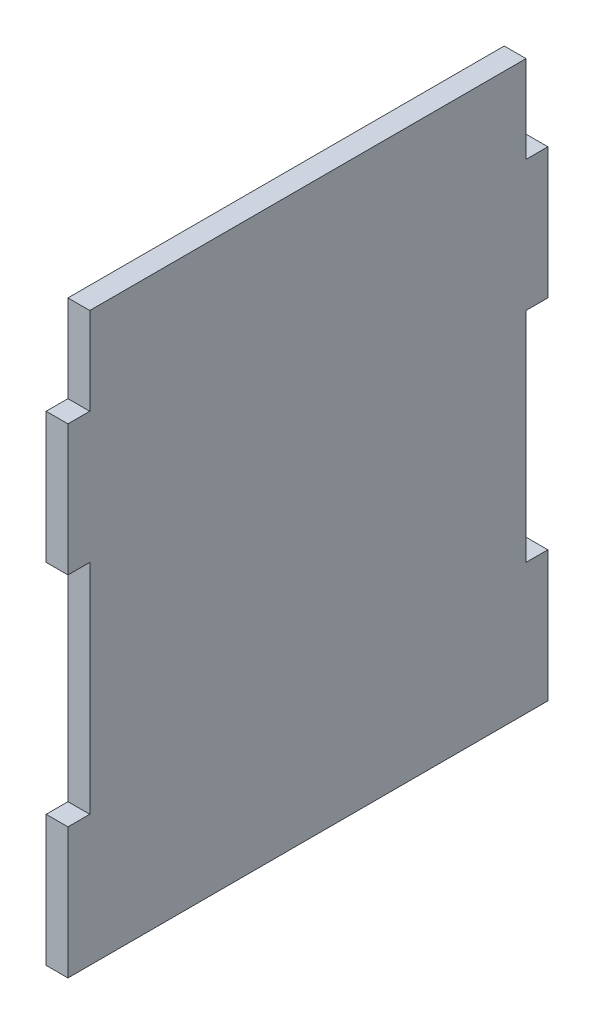
from build123d import *

# Parameters (mm, degrees)
BOSS_EXTRUDE1_DEPTH = 3.175


with BuildPart() as part:
    # Sketch1 → Boss-Extrude1 (new body)
    with BuildSketch(Plane(origin=(0, 0, 0), x_dir=(0, 0, -1), z_dir=(1, 0, 0))):
        Polygon((0, 0), (-3.175, 0), (-3.175, 19.05), (0, 19.05), (0, 50.8), (-3.175, 50.8), (-3.175, 69.85), (0, 69.85), (0, 82.55), (63.5, 82.55), (63.5, 69.85), (66.675, 69.85), (66.675, 50.8), (63.5, 50.8), (63.5, 19.05), (66.675, 19.05), (66.675, 0), (63.5, 0), align=None)
    extrude(amount=BOSS_EXTRUDE1_DEPTH)


solid = part.part
